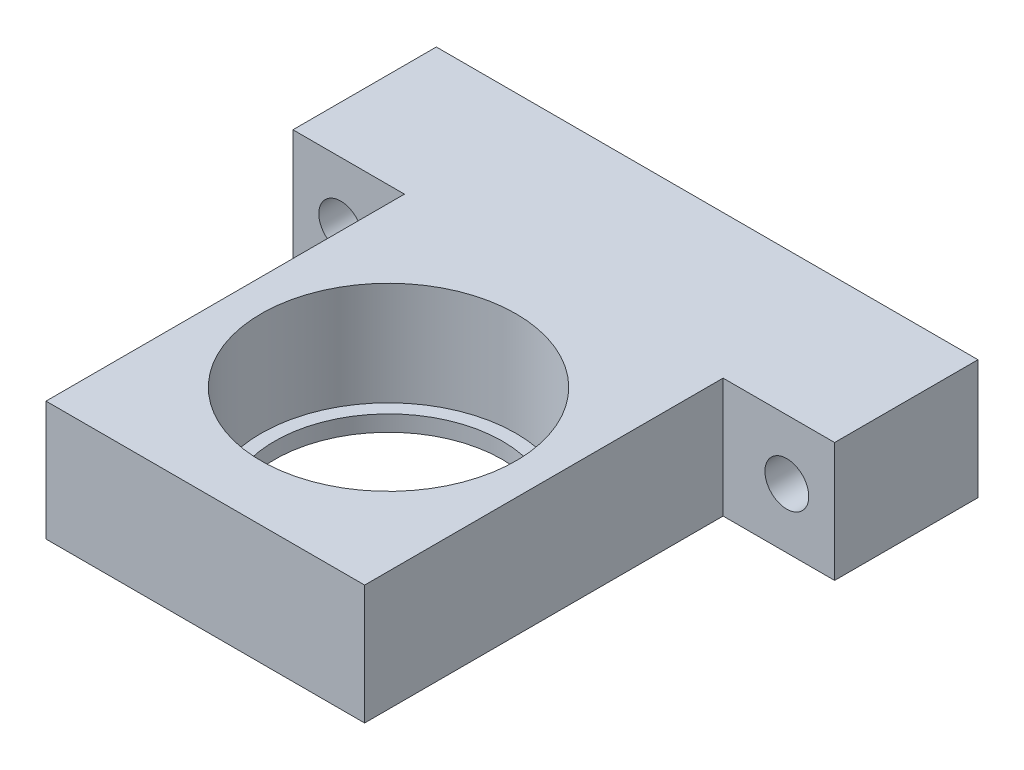
from build123d import *

# Parameters (mm, degrees)
SKETCH_1_W          = 68
SKETCH_1_H          = 15
EXTRUDE_1_DEPTH     = 18
SKETCH_2_W          = 40
SKETCH_2_H          = 15
EXTRUDE_2_DEPTH     = 45
SKETCH_3_R          = 16
CUT_EXTRUDE_1_DEPTH = 43
SKETCH_4_R          = 16
SKETCH_4_R_2        = 14.3
EXTRUDE_3_DEPTH     = 2
SKETCH_5_R          = 2.75
CUT_EXTRUDE_2_DEPTH = 21


with BuildPart() as part:
    # 草图1 → 凸台-拉伸1 (new body)
    with BuildSketch(Plane.XY):
        Rectangle(SKETCH_1_W, SKETCH_1_H)
    extrude(amount=EXTRUDE_1_DEPTH)

    # 草图2 → 凸台-拉伸2 (add)
    with BuildSketch(Plane.XY.offset(18)):
        Rectangle(SKETCH_2_W, SKETCH_2_H)
    extrude(amount=EXTRUDE_2_DEPTH)

    # 草图3 → 切除-拉伸1 (cut)
    with BuildSketch(Plane.XZ.offset(7.5)):
        with Locations((0, 40)):
            Circle(SKETCH_3_R)
    extrude(amount=-CUT_EXTRUDE_1_DEPTH, mode=Mode.SUBTRACT)

    # 草图4 → 凸台-拉伸3 (add)
    with BuildSketch(Plane.XZ.offset(7.5)):
        with Locations(Location((0, 40, 0), (0, 0, 270))):
            Circle(SKETCH_4_R)
        with Locations(Location((0, 40, 0), (0, 0, 270))):
            Circle(SKETCH_4_R_2, mode=Mode.SUBTRACT)
    extrude(amount=-EXTRUDE_3_DEPTH)

    # 草图5 → 切除-拉伸2 (cut)
    with BuildSketch(Plane.XY.offset(18)):
        with Locations((28, 0)):
            Circle(SKETCH_5_R)
        with Locations((-28, 0)):
            Circle(SKETCH_5_R)
    extrude(amount=-CUT_EXTRUDE_2_DEPTH, mode=Mode.SUBTRACT)


solid = part.part
